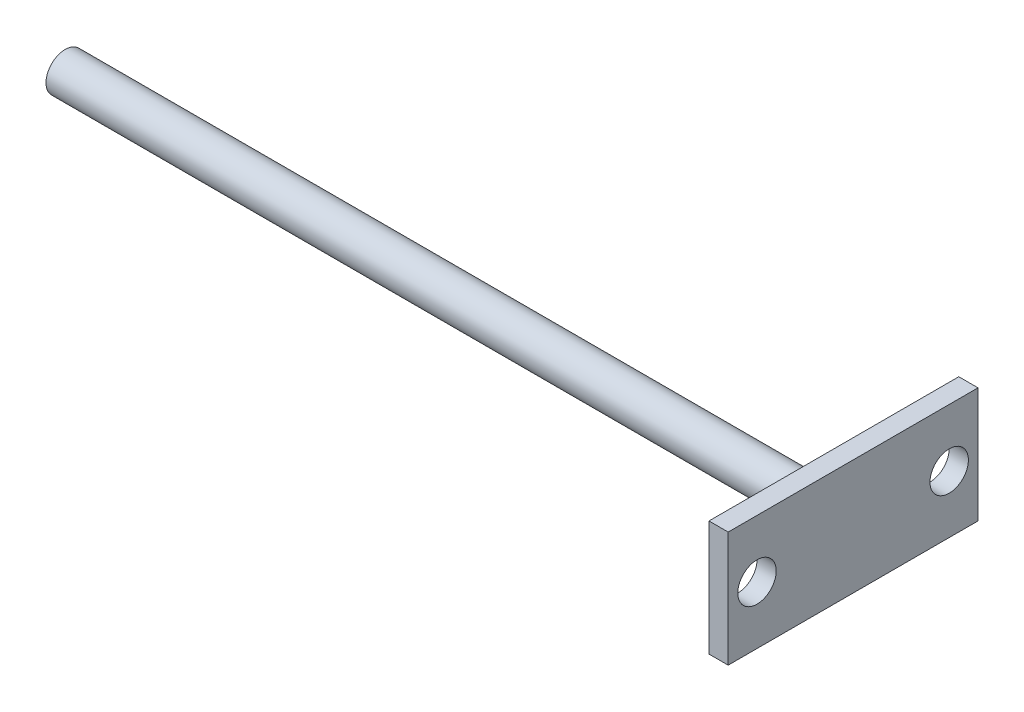
from build123d import *

# Parameters (mm, degrees)
SKETCH_1_W          = 4
SKETCH_1_H          = 6
SKETCH_1_R          = 1
EXTRUDE_1_DEPTH     = 1
SKETCH_2_W          = 3
SKETCH_2_H          = 6
SKETCH_2_R          = 1
SKETCH_2_W_2        = 3.5
EXTRUDE_2_DEPTH     = 1
FILLET_1_R          = 1
SKETCH_3_W          = 8.324991738
SKETCH_3_H          = 7.604036572
CUT_EXTRUDE_1_DEPTH = 10
EXTRUDE_3_DEPTH     = 40


with BuildPart() as part:
    # 草图1 → 凸台-拉伸1 (new body)
    with BuildSketch(Plane.XY):
        Rectangle(SKETCH_1_W, SKETCH_1_H)
        Circle(SKETCH_1_R, mode=Mode.SUBTRACT)
    extrude(amount=EXTRUDE_1_DEPTH)

    # 草图2 → 凸台-拉伸2 (add)
    # profile 1 of 2: a face of its own
    with BuildSketch(Plane(origin=(2, 0, 0), x_dir=(0, 0, -1), z_dir=(1, 0, 0))):
        with Locations((-2.5, 0)):
            Rectangle(SKETCH_2_W, SKETCH_2_H)
        with Locations(Location((-2.5, 0, 0), (0, 0, 90))):
            Circle(SKETCH_2_R, mode=Mode.SUBTRACT)
    # profile 2 of 2: a face of its own
    with BuildSketch(Plane(origin=(2, 0, 0), x_dir=(0, 0, -1), z_dir=(1, 0, 0))):
        with Locations((0.75, 0)):
            Rectangle(SKETCH_2_W_2, SKETCH_2_H)
    extrude(amount=EXTRUDE_2_DEPTH)

    # 圆角1
    fillet_1_edges = [part.edges().sort_by_distance(p)[0] for p in [
        (-2, -3, 0.5),
        (-2, 3, 0.5),
    ]]
    fillet(fillet_1_edges, radius=FILLET_1_R)

    # 镜向1: part across plane


with BuildPart() as part_1:
    add(part.part)
    add(part.part.mirror(Plane(origin=(3, 0, -2.5), x_dir=(1, 0, 0), z_dir=(0, 0, 1))))

    # 草图3 → 切除-拉伸1 (cut)
    with BuildSketch(Plane.ZY.offset(-2)):
        with Locations((-2.5, 0)):
            Rectangle(SKETCH_3_W, SKETCH_3_H)
    extrude(amount=CUT_EXTRUDE_1_DEPTH, mode=Mode.SUBTRACT)

    # 草图4 → 凸台-拉伸3 (add)
    with BuildSketch(Plane.ZY.offset(-2)):
        with BuildLine():
            ThreePointArc((-1.5, 0), (-1.792893219, 0.707106781), (-2.5, 1))
            Line((-2.5, 1), (-2.5, 0))
            Line((-2.5, 0), (-1.5, 0))
        make_face()
        with BuildLine():
            Line((-2.5, 0), (-2.5, 1))
            ThreePointArc((-2.5, 1), (-3.207106781, 0.707106781), (-3.5, 0))
            Line((-3.5, 0), (-2.5, 0))
        make_face()
        with BuildLine():
            Line((-1.5, 0), (-2.5, 0))
            Line((-2.5, 0), (-2.5, -1))
            ThreePointArc((-2.5, -1), (-1.792893219, -0.707106781), (-1.5, 0))
        make_face()
        with BuildLine():
            Line((-2.5, -1), (-2.5, 0))
            Line((-2.5, 0), (-3.5, 0))
            ThreePointArc((-3.5, 0), (-3.207106781, -0.707106781), (-2.5, -1))
        make_face()
    extrude(amount=EXTRUDE_3_DEPTH)


solid = part_1.part
